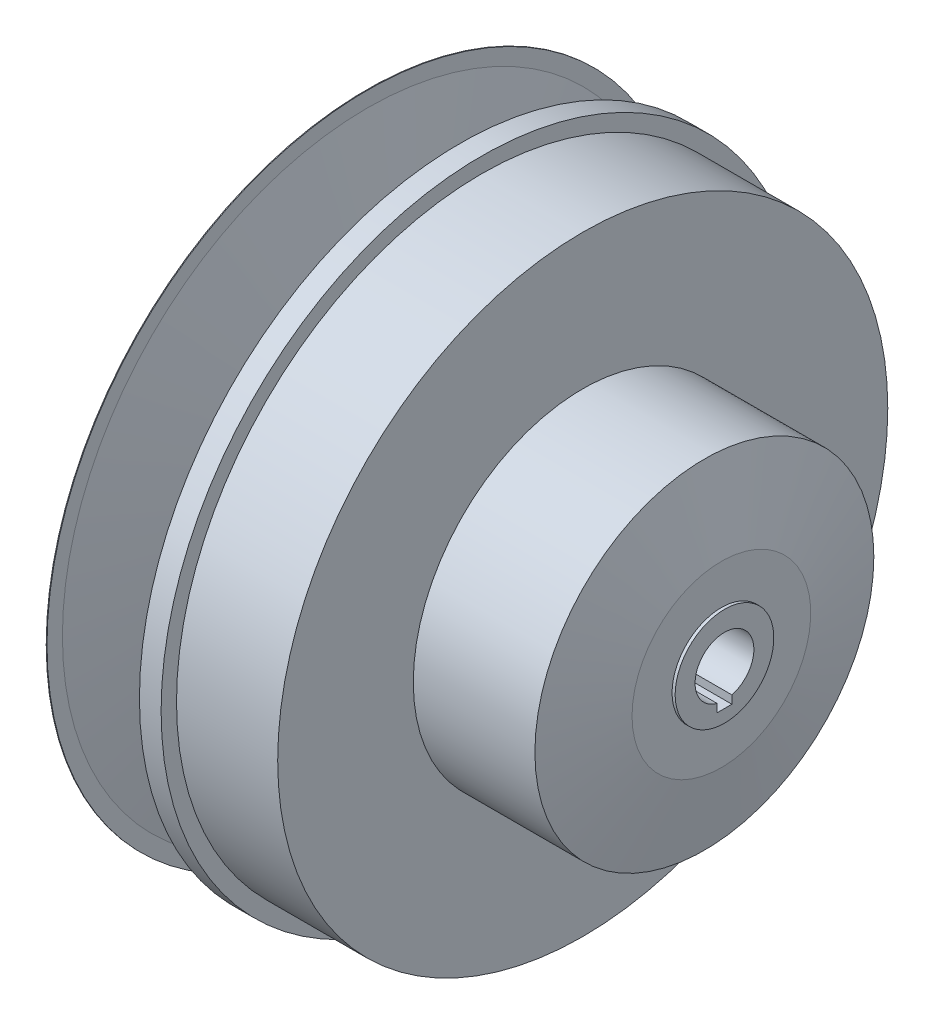
from build123d import *

# Parameters (mm, degrees)
SKETCH2_R          = 15.125
CUT_EXTRUDE5_DEPTH = 24.4
CUT_EXTRUDE6_REACH = 177.309
SKETCH3_R          = 9.543
CUT_EXTRUDE7_REACH = 192.328
SKETCH4_W          = 4.8
SKETCH4_H          = 4.648


with BuildPart() as part:
    # Sketch1 → Revolve1 (revolve)
    with BuildSketch(Plane.XY, mode=Mode.PRIVATE) as revolve1_sk:
        Polygon((-162.990125159, 0), (-162.990125159, 16.125), (-163.990125159, 16.125), (-163.990125159, 37.741454009), (-160.123125159, 37.741454009), (-160.123125159, 99), (-159.313606376, 99), (-159.313606376, 104), (-159.063606376, 104), (-159.063606376, 99), (-148.352353258, 37.189964302), (-148.352353258, 29.189964302), (-145.01123533, 29.189964302), (-145.01123533, 37.189964302), (-129.063606376, 104), (-122.028125159, 104), (-122.028125159, 99), (-89.190125159, 99), (-89.190125159, 55), (-49.716595762, 55), (-44.190125159, 29), (-44.190125159, 16.015195652), (-43.190125159, 16.015195652), (-43.190125159, 0), align=None)
    revolve(revolve1_sk.sketch.rotate(Axis((-162.990125159, 0, 0), (1, 0, 0)), 90), axis=Axis((-162.990125159, 0, 0), (1, 0, 0)))

    # Sketch2 → Cut-Extrude5 (cut)
    with BuildSketch(Plane.ZY.offset(162.990125159)):
        Circle(SKETCH2_R)
    extrude(amount=-CUT_EXTRUDE5_DEPTH, mode=Mode.SUBTRACT)

    # Sketch3 → Cut-Extrude6 (cut, up to next)
    with BuildSketch(Plane.ZY.offset(138.590125159), mode=Mode.PRIVATE) as cut_extrude6_sk1:
        Circle(SKETCH3_R)
    cut_extrude6_tool1 = extrude(cut_extrude6_sk1.sketch, amount=-CUT_EXTRUDE6_REACH, mode=Mode.PRIVATE) & part.part
    add(cut_extrude6_tool1.solids().sort_by_distance((-138.590125, 0, 0))[0], mode=Mode.SUBTRACT)

    # Sketch4 → Cut-Extrude7 (cut, up to next)
    with BuildSketch(Plane(origin=(-43.190125159, 0, 0), x_dir=(0, 0, -1), z_dir=(1, 0, 0)), mode=Mode.PRIVATE) as cut_extrude7_sk1:
        with Locations((0, -9.543)):
            Rectangle(SKETCH4_W, SKETCH4_H)
    cut_extrude7_tool1 = extrude(cut_extrude7_sk1.sketch, amount=-CUT_EXTRUDE7_REACH, mode=Mode.PRIVATE) & part.part
    add(cut_extrude7_tool1.solids().sort_by_distance((-43.190125, -9.543, 0))[0], mode=Mode.SUBTRACT)


solid = part.part
